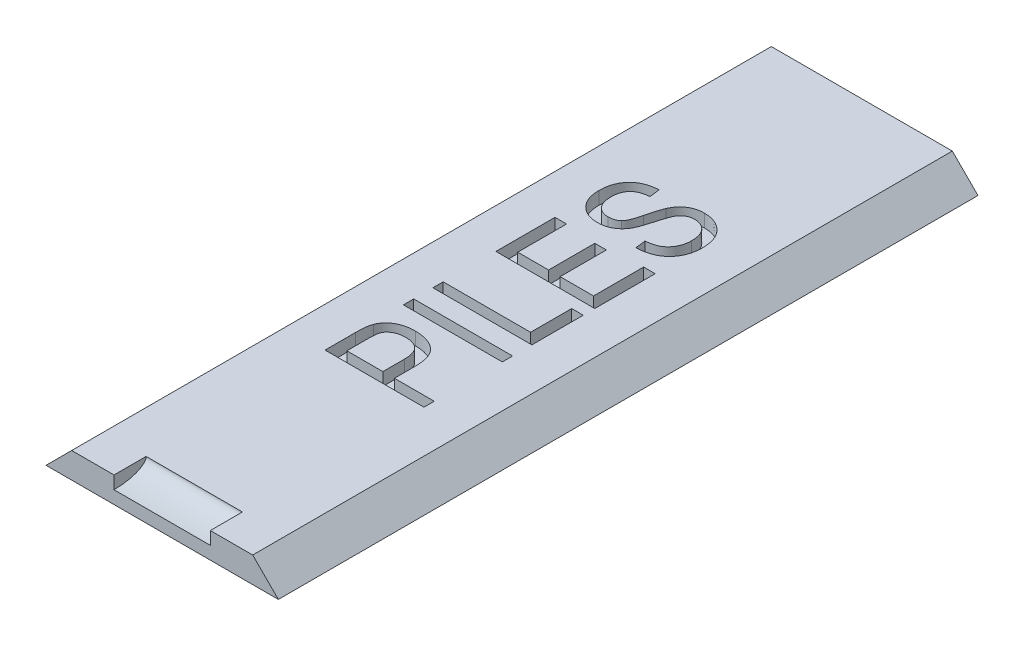
from build123d import *

# Parameters (mm, degrees)
SALIENTE_EXTRUIR1_DEPTH = 54.5
CROQUIS3_RX             = 2.5
CROQUIS3_RY             = 1
CORTAR_EXTRUIR2_DEPTH   = 3.75
CROQUIS4_W              = 7.704956055
CROQUIS4_H              = 0.800514915
CORTAR_EXTRUIR3_DEPTH   = 1


with BuildPart() as part:
    # Croquis1 → Saliente-Extruir1 (new body)
    with BuildSketch(Plane.XY):
        Polygon((0, 0), (2, 2), (16.1, 2), (18.1, 0), align=None)
    extrude(amount=SALIENTE_EXTRUIR1_DEPTH)

    # Croquis3 → Cortar-Extruir2 (cut, symmetric)
    with BuildSketch(Plane(origin=(9.05, 0, 0), x_dir=(0, 0, -1), z_dir=(1, 0, 0))):
        with Locations((-54.5, 2)):
            Ellipse(CROQUIS3_RX, CROQUIS3_RY)
    extrude(amount=CORTAR_EXTRUIR2_DEPTH, both=True, mode=Mode.SUBTRACT)

    # Croquis4 → Cortar-Extruir3 (cut)
    # profile 1 of 5: a face of its own
    with BuildSketch(Plane(origin=(0, 2, 0), x_dir=(1, 0, 0), z_dir=(0, 1, 0))):
        with BuildLine():
            Line((12.8, -37.857627175), (5.095043945, -37.857627175))
            Line((5.095043945, -37.857627175), (5.095043945, -35.484225533))
            add(Edge.make_bspline(
                [(5.095043945, -35.484225533), (5.094980356, -35.41645927), (5.094858019, -35.28608711), (5.104086961, -35.09745034), (5.113412569, -34.922072705), (5.131406897, -34.760569389), (5.151056051, -34.612818197), (5.175610039, -34.478970033), (5.206642115, -34.35899817), (5.231712725, -34.284371772), (5.243576986, -34.249056036)],
                knots=[0, 0, 0, 0, 1.301145482, 2.503209419, 3.626350361, 4.67304202, 5.622796861, 6.488461115, 7.284688674, 8, 8, 8, 8], degree=3))
            add(Edge.make_bspline(
                [(5.243576986, -34.249056036), (5.260885495, -34.204337208), (5.295461498, -34.115005521), (5.363723018, -33.989178467), (5.440620935, -33.869141169), (5.528184495, -33.756287177), (5.627665544, -33.651152746), (5.736941687, -33.552853515), (5.857069112, -33.46114539), (5.98807738, -33.377533086), (6.127757258, -33.301025407), (6.276378897, -33.23503662), (6.432461683, -33.178527771), (6.596911351, -33.13410644), (6.768439446, -33.097080686), (6.947808881, -33.073405453), (7.135097922, -33.056559339), (7.262543303, -33.055221814), (7.327730075, -33.054537686)],
                knots=[0, 0, 0, 0, 0.897100314, 1.792074795, 2.674564512, 3.564737307, 4.462262183, 5.381335128, 6.314343954, 7.288893199, 8.288957636, 9.293725154, 10.330954979, 11.394032234, 12.481204951, 13.61431922, 14.779753114, 16, 16, 16, 16], degree=3))
            add(Edge.make_bspline(
                [(7.327730075, -33.054537686), (7.41326326, -33.055861217), (7.580546111, -33.058449731), (7.825217705, -33.083864954), (8.057201134, -33.126104237), (8.277610853, -33.183735235), (8.48611401, -33.258582724), (8.682162692, -33.35126487), (8.866459009, -33.459991921), (9.039346839, -33.584119495), (9.196716469, -33.730391933), (9.331345037, -33.90302199), (9.446487819, -34.098337595), (9.53800832, -34.318776968), (9.611932142, -34.562091489), (9.662327026, -34.830487031), (9.691515, -35.122926556), (9.695786024, -35.325720431), (9.698004705, -35.43106634)],
                knots=[0, 0, 0, 0, 1.066125632, 2.085091685, 3.062630143, 4.003547869, 4.922307223, 5.820454748, 6.703048758, 7.586837887, 8.469431897, 9.371589709, 10.306565591, 11.287746888, 12.340181319, 13.471797101, 14.68666727, 16, 16, 16, 16], degree=3))
            Line((9.698004705, -35.43106634), (9.698004705, -37.05711226))
            Line((9.698004705, -37.05711226), (12.8, -37.05711226))
            Line((12.8, -37.05711226), (12.8, -37.857627175))
        make_face()
        with BuildLine():
            Line((8.797425426, -37.05711226), (8.797425426, -35.381034157))
            add(Edge.make_bspline(
                [(8.797425426, -35.381034157), (8.795996125, -35.317428031), (8.793226839, -35.194190485), (8.778462526, -35.015313546), (8.750283954, -34.849631599), (8.711755312, -34.697153279), (8.661312986, -34.558455502), (8.601209566, -34.432065182), (8.526457214, -34.320821742), (8.443436498, -34.220799107), (8.348057645, -34.133791235), (8.241519185, -34.058521135), (8.122925857, -33.995984563), (7.993955284, -33.944446765), (7.854278744, -33.903471904), (7.702798618, -33.876112199), (7.540251436, -33.858690365), (7.427841616, -33.856289283), (7.369944729, -33.855052601)],
                knots=[0, 0, 0, 0, 1.269558371, 2.459782834, 3.578031673, 4.619861022, 5.593750804, 6.519406645, 7.404988159, 8.261257356, 9.107807096, 9.973499244, 10.857552575, 11.776876264, 12.741222528, 13.757082215, 14.844781005, 16, 16, 16, 16], degree=3))
            add(Edge.make_bspline(
                [(7.369944729, -33.855052601), (7.294729329, -33.856774391), (7.149697877, -33.860094371), (6.940527179, -33.896337976), (6.747219497, -33.950573222), (6.573799968, -34.031528916), (6.422193854, -34.125776367), (6.292122995, -34.228811014), (6.191048446, -34.34482372), (6.124415481, -34.45052604), (6.087175974, -34.546051204), (6.062438504, -34.62974241), (6.040059862, -34.726156218), (6.026439575, -34.836302132), (6.011046819, -34.958048894), (6.002922877, -35.092751146), (5.995890377, -35.24024379), (5.995714922, -35.342977583), (5.995623224, -35.396669214)],
                knots=[0, 0, 0, 0, 1.500146455, 2.892604724, 4.22616096, 5.497238847, 6.698375043, 7.785577188, 8.795758489, 9.757624722, 10.261937711, 10.838005889, 11.499383255, 12.235155917, 13.052161805, 13.949201158, 14.928193621, 16, 16, 16, 16], degree=3))
            Line((5.995623224, -35.396669214), (5.995623224, -37.05711226))
            Line((5.995623224, -37.05711226), (8.797425426, -37.05711226))
        make_face(mode=Mode.SUBTRACT)
    # profile 2 of 5: a face of its own
    with BuildSketch(Plane(origin=(0, 2, 0), x_dir=(1, 0, 0), z_dir=(0, 1, 0))):
        with Locations((8.947521973, -31.353443493)):
            Rectangle(CROQUIS4_W, CROQUIS4_H)
    # profile 3 of 5: a face of its own
    with BuildSketch(Plane(origin=(0, 2, 0), x_dir=(1, 0, 0), z_dir=(0, 1, 0))):
        Polygon((12.8, -29.45222057), (5.095043945, -29.45222057), (5.095043945, -28.651705655), (11.899420721, -28.651705655), (11.899420721, -25.449645996), (12.8, -25.449645996), align=None)
    # profile 4 of 5: a face of its own
    with BuildSketch(Plane(origin=(0, 2, 0), x_dir=(1, 0, 0), z_dir=(0, 1, 0))):
        Polygon((12.8, -24.549066717), (5.095043945, -24.549066717), (5.095043945, -19.946105957), (5.995623224, -19.946105957), (5.995623224, -23.748551802), (8.397167969, -23.748551802), (8.397167969, -20.146234686), (9.297747248, -20.146234686), (9.297747248, -23.748551802), (11.899420721, -23.748551802), (11.899420721, -19.846041593), (12.8, -19.846041593), align=None)
    # profile 5 of 5: a face of its own
    with BuildSketch(Plane(origin=(0, 2, 0), x_dir=(1, 0, 0), z_dir=(0, 1, 0))):
        with BuildLine():
            Line((10.298390891, -18.845397949), (10.198326527, -18.044883034))
            add(Edge.make_bspline(
                [(10.198326527, -18.044883034), (10.300245283, -18.033239103), (10.493534985, -18.011156299), (10.764117458, -17.95046041), (10.999106162, -17.870125537), (11.20258806, -17.76859122), (11.376886078, -17.641968523), (11.532612043, -17.494769502), (11.668911614, -17.3229044), (11.785610568, -17.128875372), (11.881221369, -16.916608864), (11.949771269, -16.689109237), (11.991524351, -16.448508539), (11.996792299, -16.284024614), (11.999485085, -16.199946317)],
                knots=[0, 0, 0, 0, 1.280778799, 2.429006815, 3.456446437, 4.376522676, 5.25823019, 6.137819947, 7.045792748, 7.989273456, 8.95968453, 9.946210303, 10.950176202, 12, 12, 12, 12], degree=3))
            add(Edge.make_bspline(
                [(11.999485085, -16.199946317), (11.998260799, -16.139964542), (11.995881497, -16.023394849), (11.978136224, -15.853620198), (11.951038016, -15.693842282), (11.910125753, -15.544789438), (11.858172608, -15.406198992), (11.796293264, -15.27699083), (11.720028012, -15.159325337), (11.63489218, -15.051162751), (11.538485867, -14.956354332), (11.437624868, -14.870953398), (11.328150788, -14.800127324), (11.212135695, -14.741268069), (11.087965923, -14.69897916), (10.958727191, -14.664593031), (10.821651328, -14.646236426), (10.727881961, -14.643893744), (10.67988628, -14.642694647)],
                knots=[0, 0, 0, 0, 1.250368061, 2.429988454, 3.555466068, 4.625717287, 5.646966169, 6.638353842, 7.605933407, 8.564748095, 9.502142402, 10.420384068, 11.315510552, 12.214519894, 13.125272963, 14.045056381, 14.999365656, 16, 16, 16, 16], degree=3))
            add(Edge.make_bspline(
                [(10.67988628, -14.642694647), (10.624524507, -14.644415428), (10.516693223, -14.647767091), (10.359722303, -14.676299373), (10.214245389, -14.724938371), (10.079199114, -14.79118704), (9.955482967, -14.87662607), (9.8441733, -14.982833489), (9.743667213, -15.107243061), (9.669375813, -15.227716133), (9.614396957, -15.342941555), (9.5698493, -15.453040544), (9.519616965, -15.584151902), (9.466591701, -15.738021094), (9.410989779, -15.91390997), (9.351533296, -16.112112066), (9.287293961, -16.331871605), (9.244874633, -16.486522776), (9.222698975, -16.567370155)],
                knots=[0, 0, 0, 0, 1.005098215, 1.957687139, 2.885733572, 3.78329401, 4.681403461, 5.605578984, 6.568089027, 7.579631243, 8.168180425, 8.885482001, 9.736450909, 10.718456922, 11.841193521, 13.087089992, 14.477210763, 16, 16, 16, 16], degree=3))
            add(Edge.make_bspline(
                [(9.222698975, -16.567370155), (9.202221742, -16.639922433), (9.162758959, -16.779741854), (9.099699621, -16.980287667), (9.038147219, -17.164872213), (8.973569196, -17.333193321), (8.908564008, -17.484812772), (8.844511509, -17.621030647), (8.779123799, -17.740380158), (8.690335901, -17.876433249), (8.569970068, -18.02648796), (8.409501907, -18.186172186), (8.230371158, -18.32432529), (8.03397298, -18.440138411), (7.822544119, -18.533972759), (7.594668253, -18.596129549), (7.354912222, -18.639475089), (7.189823395, -18.643313558), (7.105712266, -18.645269221)],
                knots=[0, 0, 0, 0, 1.11393077, 2.146716259, 3.106268884, 3.988737651, 4.809862157, 5.543595319, 6.212328163, 6.818977705, 7.942346038, 9.047832148, 10.156933811, 11.275646334, 12.410283173, 13.563353315, 14.758552549, 16, 16, 16, 16], degree=3))
            add(Edge.make_bspline(
                [(7.105712266, -18.645269221), (7.030048184, -18.64354378), (6.881307845, -18.640151913), (6.663608738, -18.611192224), (6.455744179, -18.565298603), (6.25996175, -18.496782308), (6.073372971, -18.413072558), (5.899733727, -18.306407326), (5.733908525, -18.184634175), (5.581689535, -18.042622434), (5.444344758, -17.88459609), (5.322608171, -17.713485618), (5.221087638, -17.52800009), (5.137590726, -17.329503353), (5.073676796, -17.117699379), (5.029227138, -16.893002937), (4.999862466, -16.655698183), (4.996634929, -16.492934655), (4.994979581, -16.40945608)],
                knots=[0, 0, 0, 0, 1.048393069, 2.060929513, 3.038830284, 3.993780679, 4.931247035, 5.867877984, 6.812802159, 7.778917813, 8.746652657, 9.710740501, 10.683960439, 11.671447009, 12.69068745, 13.744764791, 14.843329183, 16, 16, 16, 16], degree=3))
            add(Edge.make_bspline(
                [(4.994979581, -16.40945608), (4.997921164, -16.295603833), (5.003663138, -16.073364066), (5.058789856, -15.751927871), (5.143459756, -15.451169647), (5.266443936, -15.174821537), (5.420542193, -14.923510607), (5.607917584, -14.70202282), (5.824047697, -14.508778632), (6.071345545, -14.348022234), (6.344133462, -14.21791082), (6.641210866, -14.122636218), (6.960980837, -14.060522906), (7.182558754, -14.048492593), (7.296459961, -14.042308461)],
                knots=[0, 0, 0, 0, 1.103033465, 2.153123098, 3.152679255, 4.125499792, 5.076296761, 6.001544301, 6.928570303, 7.877444987, 8.851642669, 9.850432098, 10.895023555, 12, 12, 12, 12], degree=3))
            Line((7.296459961, -14.042308461), (7.396524325, -14.842823375))
            add(Edge.make_bspline(
                [(7.396524325, -14.842823375), (7.334909439, -14.848695585), (7.214755653, -14.860146848), (7.041910653, -14.891790508), (6.880746628, -14.932222608), (6.732182998, -14.982957125), (6.596637739, -15.046559498), (6.472667255, -15.118085986), (6.36035298, -15.199663901), (6.261468066, -15.292435017), (6.175056249, -15.395180895), (6.09883373, -15.506661735), (6.036856225, -15.62964389), (5.985176538, -15.761577704), (5.944159114, -15.902764713), (5.916722615, -16.054199383), (5.899237841, -16.215172805), (5.896806104, -16.326021773), (5.89555886, -16.382876483)],
                knots=[0, 0, 0, 0, 1.224893265, 2.388636439, 3.474727904, 4.51239488, 5.491031007, 6.434269947, 7.342314655, 8.23289818, 9.11144624, 9.995731571, 10.900193307, 11.831391373, 12.797987004, 13.805778543, 14.874578387, 16, 16, 16, 16], degree=3))
            add(Edge.make_bspline(
                [(5.89555886, -16.382876483), (5.896054877, -16.440787597), (5.897013612, -16.552721902), (5.915925514, -16.715522438), (5.94090197, -16.867969167), (5.978936278, -17.010268999), (6.026936513, -17.141195661), (6.085544435, -17.262570645), (6.155298555, -17.372745546), (6.235727097, -17.472316977), (6.325159891, -17.55951757), (6.420272517, -17.636229909), (6.521432674, -17.701833097), (6.630166642, -17.752964264), (6.744857593, -17.793798694), (6.86573665, -17.823809459), (6.993172521, -17.840901513), (7.080124981, -17.843452961), (7.124474335, -17.844754306)],
                knots=[0, 0, 0, 0, 1.28677749, 2.487165856, 3.639785246, 4.719183444, 5.756778416, 6.736320351, 7.710431992, 8.649732596, 9.575714218, 10.482424581, 11.363216052, 12.249555033, 13.147559346, 14.066626488, 15.013899474, 16, 16, 16, 16], degree=3))
            add(Edge.make_bspline(
                [(7.124474335, -17.844754306), (7.203948402, -17.842021971), (7.355573865, -17.836809057), (7.568820918, -17.790546084), (7.755022258, -17.710953611), (7.856563541, -17.631762234), (7.906227181, -17.593029889)],
                knots=[0, 0, 0, 0, 1.13496852, 2.165362018, 3.1026822, 4, 4, 4, 4], degree=3))
            add(Edge.make_bspline(
                [(7.906227181, -17.593029889), (7.929976599, -17.569213366), (7.981559097, -17.517485117), (8.046547605, -17.41785828), (8.11491766, -17.299268127), (8.176926937, -17.155552802), (8.241945405, -16.991950021), (8.301554918, -16.804329075), (8.363231048, -16.595069565), (8.399856978, -16.446623455), (8.419057048, -16.368804932)],
                knots=[0, 0, 0, 0, 0.600125557, 1.303441474, 2.117395318, 3.047759802, 4.098473224, 5.265768101, 6.566659033, 8, 8, 8, 8], degree=3))
            add(Edge.make_bspline(
                [(8.419057048, -16.368804932), (8.437532902, -16.292120421), (8.473034226, -16.144771246), (8.528769284, -15.933566677), (8.579047478, -15.739024427), (8.631391143, -15.563356129), (8.679114551, -15.404488221), (8.726833716, -15.264209433), (8.768721562, -15.140027096), (8.801139177, -15.065185615), (8.816187494, -15.030444059)],
                knots=[0, 0, 0, 0, 1.354622716, 2.602905581, 3.751413711, 4.805080968, 5.750717443, 6.599847983, 7.350046792, 8, 8, 8, 8], degree=3))
            add(Edge.make_bspline(
                [(8.816187494, -15.030444059), (8.861370137, -14.936598502), (8.949102246, -14.754376566), (9.123526995, -14.513799329), (9.317376635, -14.304685758), (9.541188072, -14.136526199), (9.787542657, -14.003156341), (10.057939774, -13.909853566), (10.350144909, -13.852082467), (10.55244374, -13.845541869), (10.656433695, -13.842179732)],
                knots=[0, 0, 0, 0, 1.070359847, 2.078340734, 3.046206706, 3.99595094, 4.946634449, 5.919011396, 6.930285904, 8, 8, 8, 8], degree=3))
            add(Edge.make_bspline(
                [(10.656433695, -13.842179732), (10.760939545, -13.845580405), (10.967433488, -13.852299821), (11.269478638, -13.911933885), (11.55730663, -14.009380769), (11.8263012, -14.145643523), (12.073797674, -14.312538154), (12.293676699, -14.508215947), (12.478125149, -14.735940352), (12.632398167, -14.989076424), (12.7537754, -15.270496798), (12.838621751, -15.579327696), (12.891174876, -15.915159096), (12.897032502, -16.148147543), (12.900064364, -16.268740567)],
                knots=[0, 0, 0, 0, 1.01143777, 1.998507955, 2.969111388, 3.946647698, 4.909937751, 5.853623903, 6.786336586, 7.737808315, 8.716842446, 9.744489446, 10.832565119, 12, 12, 12, 12], degree=3))
            add(Edge.make_bspline(
                [(12.900064364, -16.268740567), (12.898074172, -16.363692947), (12.894190571, -16.548980105), (12.860723643, -16.819001424), (12.806332453, -17.07402187), (12.729470973, -17.314467733), (12.631030103, -17.541449592), (12.508259205, -17.752587294), (12.365493714, -17.949791426), (12.200627758, -18.129439314), (12.017900235, -18.29197591), (11.81864938, -18.435267169), (11.60268459, -18.555883932), (11.371673853, -18.656311624), (11.125416104, -18.73562644), (10.864001495, -18.795541559), (10.586568179, -18.832915533), (10.395961112, -18.84117169), (10.298390891, -18.845397949)],
                knots=[0, 0, 0, 0, 1.105181298, 2.156616858, 3.162303259, 4.137147331, 5.090895204, 6.036968316, 6.975166548, 7.920090863, 8.869970344, 9.81800681, 10.771619553, 11.744478679, 12.746148078, 13.779480727, 14.863334085, 16, 16, 16, 16], degree=3))
        make_face()
    extrude(amount=-CORTAR_EXTRUIR3_DEPTH, mode=Mode.SUBTRACT)


solid = part.part
